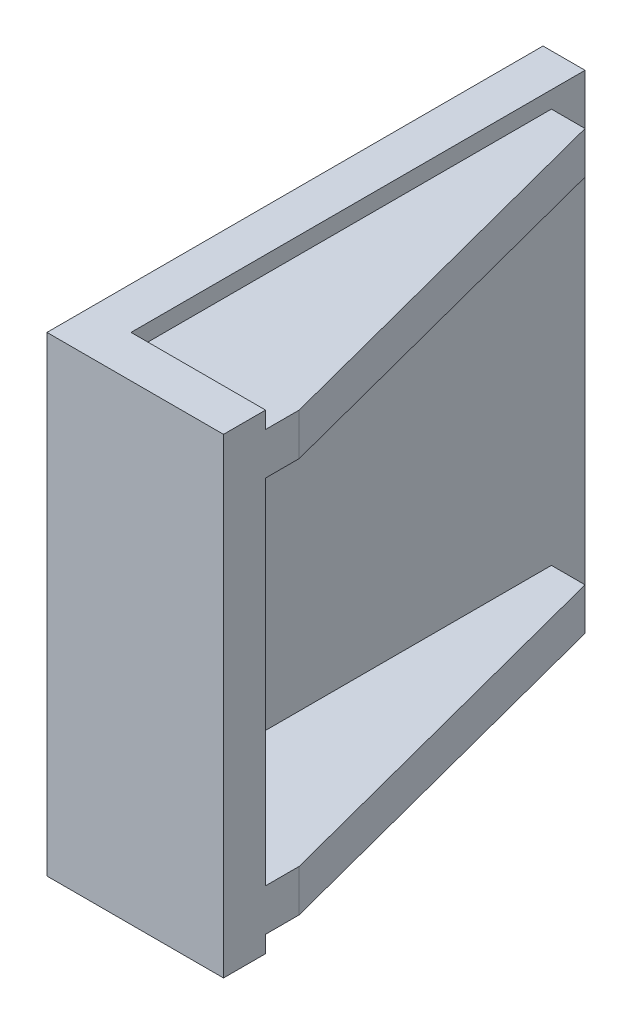
from build123d import *

# Parameters (mm, degrees)
SKETCH_1_W      = 25
SKETCH_1_H      = 280
EXTRUDE_1_DEPTH = 147.5
SKETCH_2_W      = 80
SKETCH_2_H      = 25
EXTRUDE_2_DEPTH = 280
EXTRUDE_3_DEPTH = 25


with BuildPart() as part:
    # 草图1 → 凸台-拉伸1 (new, symmetric)
    with BuildSketch(Plane.XY):
        Rectangle(SKETCH_1_W, SKETCH_1_H)
    extrude(amount=EXTRUDE_1_DEPTH, both=True)

    # 草图2 → 凸台-拉伸2 (add)
    with BuildSketch(Plane(origin=(0, 140, 0), x_dir=(1, 0, 0), z_dir=(0, 1, 0))):
        with Locations((52.5, -135)):
            Rectangle(SKETCH_2_W, SKETCH_2_H)
    extrude(amount=-EXTRUDE_2_DEPTH)

    # 草图4 → 凸台-拉伸3 (add)
    with BuildSketch(Plane(origin=(0, 130, 0), x_dir=(1, 0, 0), z_dir=(0, 1, 0))):
        Polygon((12.5, 127.5), (32.5, 127.5), (92.5, -102.5), (92.5, -122.5), (12.5, -122.5), align=None)
    extrude_3 = extrude(amount=-EXTRUDE_3_DEPTH)

    # 镜向1: 凸台-拉伸3 across plane
    add(extrude_3.mirror(Plane.ZX))


solid = part.part
